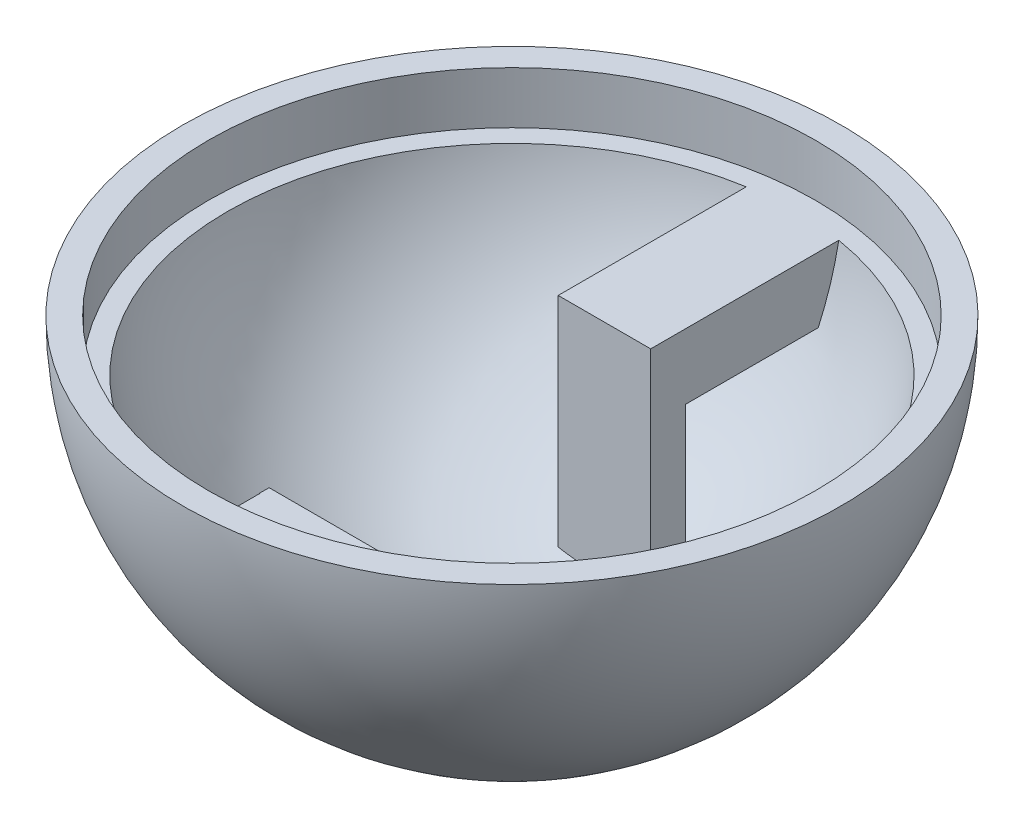
from build123d import *

# Parameters (mm, degrees)
CUT_EXTRUDE1_DEPTH  = 33
BOSS_EXTRUDE2_START = -6.898371775
SKETCH3_W           = 18
SKETCH3_H           = 0.818990312
BOSS_EXTRUDE2_DEPTH = 10.555064026
SKETCH4_W           = 8
SKETCH4_H           = 3
BOSS_EXTRUDE3_DEPTH = 21
SKETCH6_W           = 8
SKETCH6_H           = 5.661156415
BOSS_EXTRUDE4_DEPTH = 15
SKETCH7_W           = 17.96730976
SKETCH7_H           = 0.5
BOSS_EXTRUDE7_DEPTH = 11


with BuildPart() as part:
    # Sketch1 → Revolve1 (revolve)
    with BuildSketch(Plane.XY):
        with BuildLine():
            Line((-26.25, 0), (-28.5, 0))
            ThreePointArc((-28.5, 0), (-20.152543264, -20.152543264), (0, -28.5))
            Line((0, -28.5), (0, -25))
            ThreePointArc((0, -25), (-16.007810594, -19.20286437), (-24.591665255, -4.5))
            Line((-24.591665255, -4.5), (-26.25, -4.5))
            Line((-26.25, -4.5), (-26.25, 0))
        make_face()
    revolve(axis=Axis((0, 0, 0), (0, -1, 0)))

    # Sketch2 → Cut-Extrude1 (cut)
    with BuildSketch(Plane(origin=(0, 0, 0), x_dir=(1, 0, 0), z_dir=(0, 1, 0))):
        Polygon((-5, -9.5), (-5, -5.5), (5, -5.5), (5, -9.5), (11, -9.5), (11, -11), (-11, -11), (-11, -9.5), align=None)
    extrude(amount=-CUT_EXTRUDE1_DEPTH, mode=Mode.SUBTRACT)

    # Sketch3 → Boss-Extrude2 (add)
    with BuildSketch(Plane(origin=(0, -4.5, 0), x_dir=(1, 0, 0), z_dir=(0, 1, 0)).offset(BOSS_EXTRUDE2_START)):
        with Locations((0, -12.409495156)):
            Rectangle(SKETCH3_W, SKETCH3_H)
    extrude(amount=-BOSS_EXTRUDE2_DEPTH)

    # Sketch4 → Boss-Extrude3 (add)
    with BuildSketch(Plane(origin=(0, -4.5, 0), x_dir=(1, 0, 0), z_dir=(0, 1, 0))):
        with Locations((0, 9.5)):
            Rectangle(SKETCH4_W, SKETCH4_H)
    extrude(amount=-BOSS_EXTRUDE3_DEPTH)

    # Sketch6 → Boss-Extrude4 (add)
    with BuildSketch(Plane(origin=(0, 0, -11), x_dir=(-1, 0, 0), z_dir=(0, 0, -1))):
        with Locations((0, -7.330578208)):
            Rectangle(SKETCH6_W, SKETCH6_H)
    extrude(amount=BOSS_EXTRUDE4_DEPTH)

    # Sketch7 → Boss-Extrude7 (add)
    with BuildSketch(Plane.XY.offset(12.818990312)):
        with Locations((0.01634512, -11.648371775)):
            Rectangle(SKETCH7_W, SKETCH7_H)
    extrude(amount=BOSS_EXTRUDE7_DEPTH)


solid = part.part
